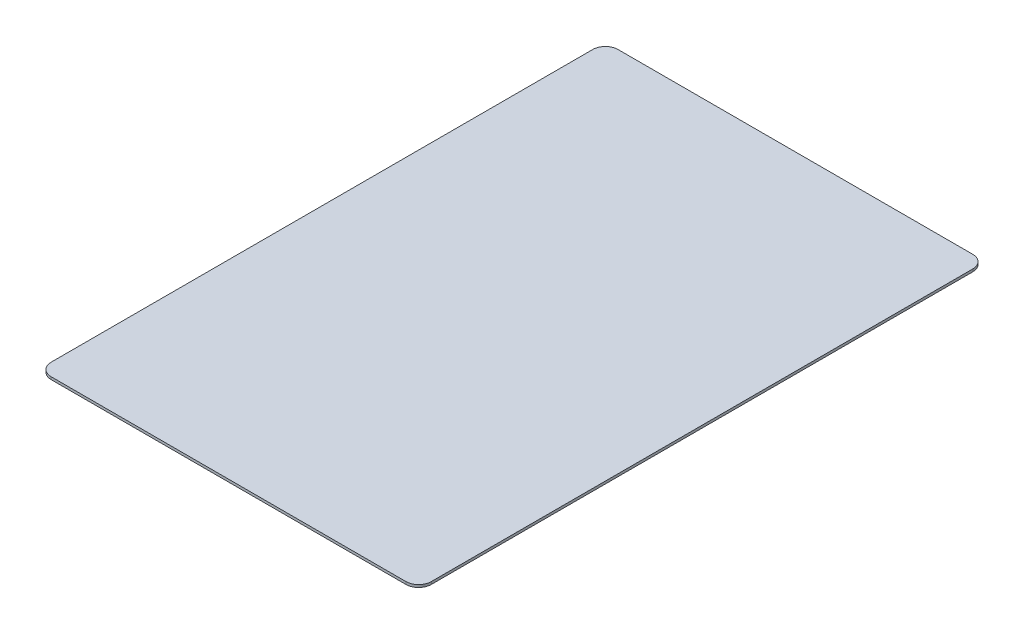
from build123d import *

# Parameters (mm, degrees)
SKETCH1_W           = 447.412893907
SKETCH1_H           = 300
BOSS_EXTRUDE1_DEPTH = 2
FILLET1_R           = 10


with BuildPart() as part:
    # Sketch1 → Boss-Extrude1 (new body)
    with BuildSketch(Plane(origin=(0, -440.404976336, -903.561423627), x_dir=(0, 0, -1), z_dir=(0, 1, 0))):
        with Locations((-392.800183226, -341.40497634)):
            Rectangle(SKETCH1_W, SKETCH1_H)
    extrude(amount=BOSS_EXTRUDE1_DEPTH)

    # Fillet1
    fillet1_edges = [part.edges().sort_by_distance(p)[0] for p in [
        (191.40497634, -439.404976336, -287.054793447),
        (491.40497634, -439.404976336, -287.054793447),
        (491.40497634, -439.404976336, -734.467687355),
        (191.40497634, -439.404976336, -734.467687355),
    ]]
    fillet(fillet1_edges, radius=FILLET1_R)


solid = part.part
